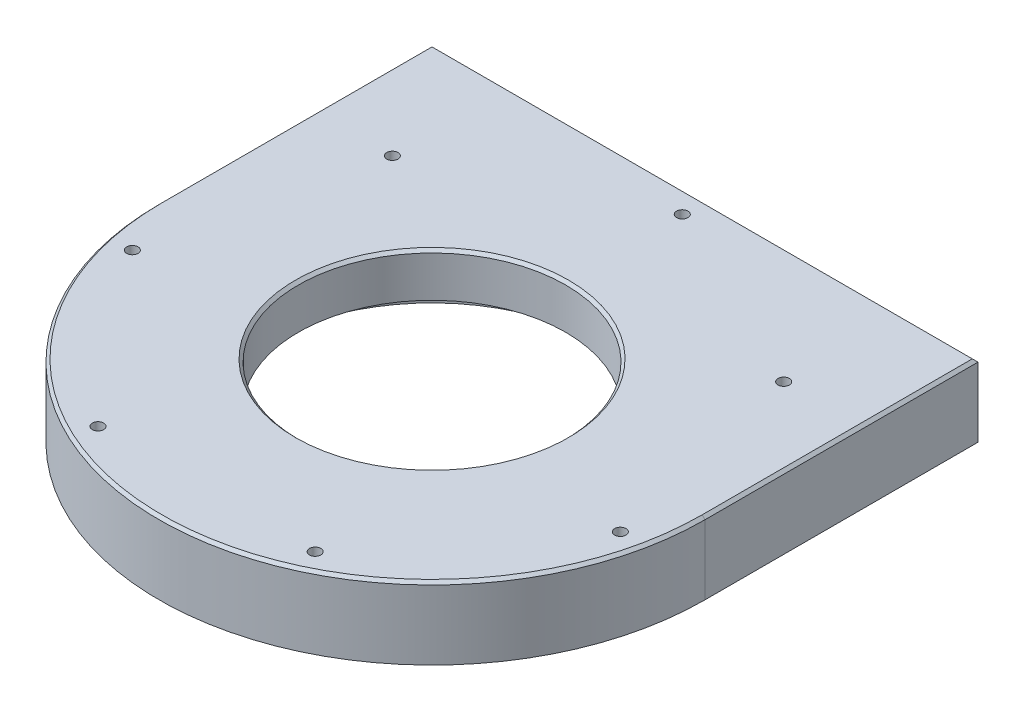
from build123d import *

# Parameters (mm, degrees)
SKETCH2_W           = 96
SKETCH2_H           = 48
BOSS_EXTRUDE1_DEPTH = 12.7
SKETCH1_R           = 48
SKETCH1_R_2         = 23.5
SKETCH1_R_3         = 1
BOSS_EXTRUDE2_DEPTH = 12.7
SKETCH1_2_R         = 23.5
SKETCH1_2_R_2       = 1
CUT_EXTRUDE1_DEPTH  = 12.7
SKETCH3_R           = 30
CUT_EXTRUDE3_DEPTH  = 5
CHAMFER1_SIZE       = 0.5


with BuildPart() as part:
    # Sketch2 → Boss-Extrude1 (new body)
    with BuildSketch(Plane(origin=(0, 0, 0), x_dir=(1, 0, 0), z_dir=(0, 1, 0))):
        with Locations((0, 24)):
            Rectangle(SKETCH2_W, SKETCH2_H)
    extrude(amount=BOSS_EXTRUDE1_DEPTH)

    # Sketch1 → Boss-Extrude2 (add)
    with BuildSketch(Plane(origin=(0, 0, 0), x_dir=(1, 0, 0), z_dir=(0, 1, 0))):
        Circle(SKETCH1_R)
        Circle(SKETCH1_R_2, mode=Mode.SUBTRACT)
        with Locations((0, 44)):
            Circle(SKETCH1_R_3, mode=Mode.SUBTRACT)
        with Locations((34.400585229, 27.433551282)):
            Circle(SKETCH1_R_3, mode=Mode.SUBTRACT)
        with Locations((42.896828136, -9.790921094)):
            Circle(SKETCH1_R_3, mode=Mode.SUBTRACT)
        with Locations((19.090884521, -39.642630188)):
            Circle(SKETCH1_R_3, mode=Mode.SUBTRACT)
        with Locations((-19.090884521, -39.642630188)):
            Circle(SKETCH1_R_3, mode=Mode.SUBTRACT)
        with Locations((-42.896828136, -9.790921094)):
            Circle(SKETCH1_R_3, mode=Mode.SUBTRACT)
        with Locations((-34.400585229, 27.433551282)):
            Circle(SKETCH1_R_3, mode=Mode.SUBTRACT)
    extrude(amount=BOSS_EXTRUDE2_DEPTH)

    # Sketch1<2> → Cut-Extrude1 (cut)
    with BuildSketch(Plane(origin=(0, 0, 0), x_dir=(1, 0, 0), z_dir=(0, 1, 0))):
        Circle(SKETCH1_2_R)
        with Locations((0, 44)):
            Circle(SKETCH1_2_R_2)
        with Locations((34.400585229, 27.433551282)):
            Circle(SKETCH1_2_R_2)
        with Locations((-34.400585229, 27.433551282)):
            Circle(SKETCH1_2_R_2)
    extrude(amount=CUT_EXTRUDE1_DEPTH, mode=Mode.SUBTRACT)

    # Sketch3 → Cut-Extrude3 (cut)
    with BuildSketch(Plane(origin=(0, 0, 0), x_dir=(1, 0, 0), z_dir=(0, 1, 0))):
        Circle(SKETCH3_R)
    extrude(amount=CUT_EXTRUDE3_DEPTH, mode=Mode.SUBTRACT)

    # Chamfer1
    chamfer1_edges = [part.edges().sort_by_distance(p)[0] for p in [
        (-23.5, 12.7, 0),
        (48, 12.7, -24),
        (0, 12.7, 48),
        (-48, 12.7, -24),
        (0, 12.7, -48),
    ]]
    chamfer(chamfer1_edges, length=CHAMFER1_SIZE)


solid = part.part
